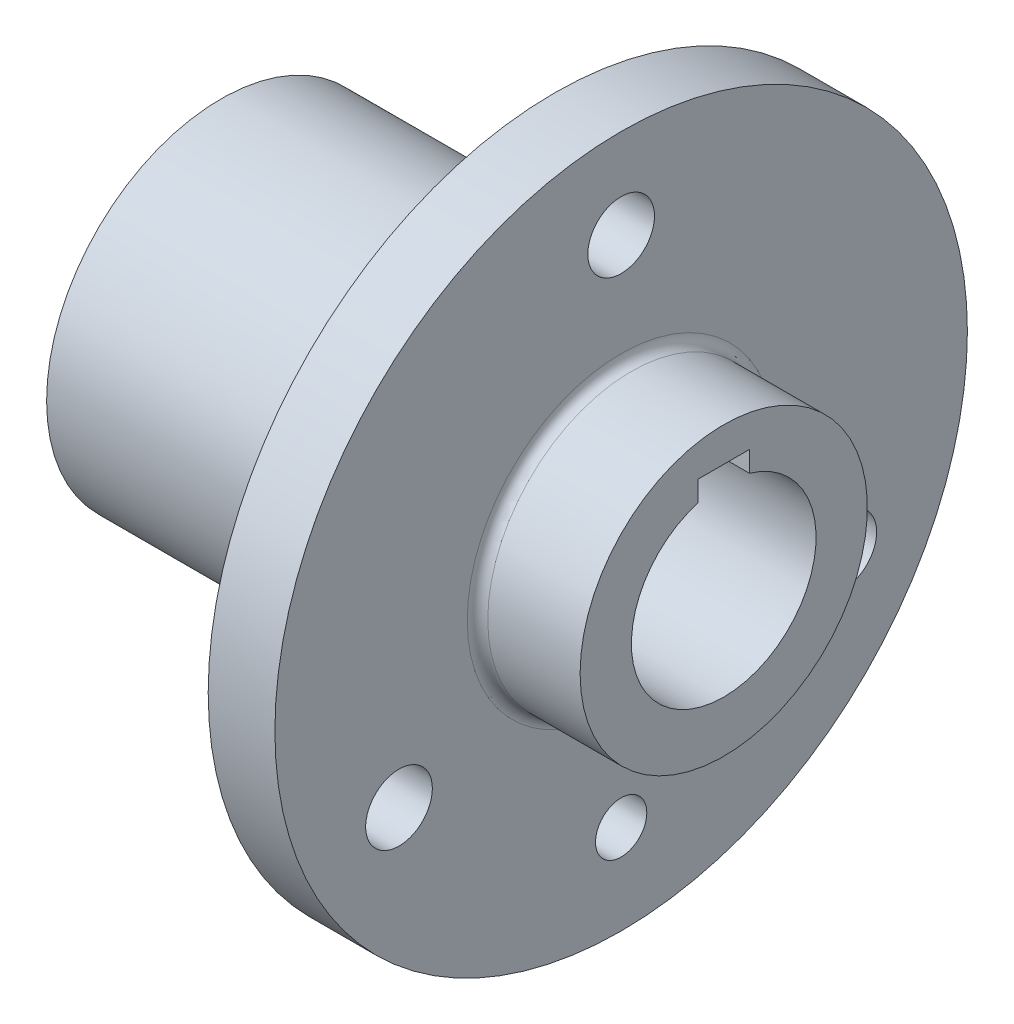
from build123d import *

# Parameters (mm, degrees)
FILLET1_R          = 2
FILLET2_R          = 2
SKETCH2_W          = 10
SKETCH2_H          = 6.6
CUT_EXTRUDE1_DEPTH = 52
SKETCH3_R          = 6.5
SKETCH3_R_2        = 5
CUT_EXTRUDE2_DEPTH = 52


with BuildPart() as part:
    # Sketch1 → Revolve1 (revolve)
    with BuildSketch(Plane.XY, mode=Mode.PRIVATE) as revolve1_sk:
        Polygon((-48.746583118, 0), (-48.746583118, 5), (-43.746583118, 5), (-43.746583118, 24), (21.253416882, 24), (21.253416882, 57.5), (34.253416882, 57.5), (34.253416882, 18), (54.253416882, 18), (54.253416882, 8), (2.253416882, 8), (2.253416882, 14), (-33.746583118, 14), (-33.746583118, 3), (-36.746583118, 0), align=None)
    revolve(revolve1_sk.sketch.rotate(Axis((-48.746583118, -10, 0), (1, 0, 0)), 90), axis=Axis((-48.746583118, -10, 0), (1, 0, 0)))

    # Fillet1
    fillet1_edges = [part.edges().sort_by_distance(p)[0] for p in [
        (-43.746583118, -10, -15),
        (21.253416882, -10, -34),
        (34.253416882, -10, -28),
    ]]
    fillet(fillet1_edges, radius=FILLET1_R)

    # Fillet2
    fillet2_edges = [part.edges().sort_by_distance(p)[0] for p in [
        (2.253416882, -10, -18),
        (-33.746583118, -10, -24),
    ]]
    fillet(fillet2_edges, radius=FILLET2_R)

    # Sketch2 → Cut-Extrude1 (cut)
    with BuildSketch(Plane(origin=(54.253416882, 0, 0), x_dir=(0, 0, -1), z_dir=(1, 0, 0))):
        with Locations((0, 8)):
            Rectangle(SKETCH2_W, SKETCH2_H)
    extrude(amount=-CUT_EXTRUDE1_DEPTH, mode=Mode.SUBTRACT)

    # Sketch3 → Cut-Extrude2 (cut)
    with BuildSketch(Plane(origin=(34.253416882, 0, 0), x_dir=(0, 0, -1), z_dir=(1, 0, 0))):
        with Locations((0, 40)):
            Circle(SKETCH3_R)
        with Locations((43.301270189, -35)):
            Circle(SKETCH3_R)
        with Locations((-43.301270189, -35)):
            Circle(SKETCH3_R)
        with Locations((0, -60)):
            Circle(SKETCH3_R_2)
    extrude(amount=-CUT_EXTRUDE2_DEPTH, mode=Mode.SUBTRACT)


solid = part.part
